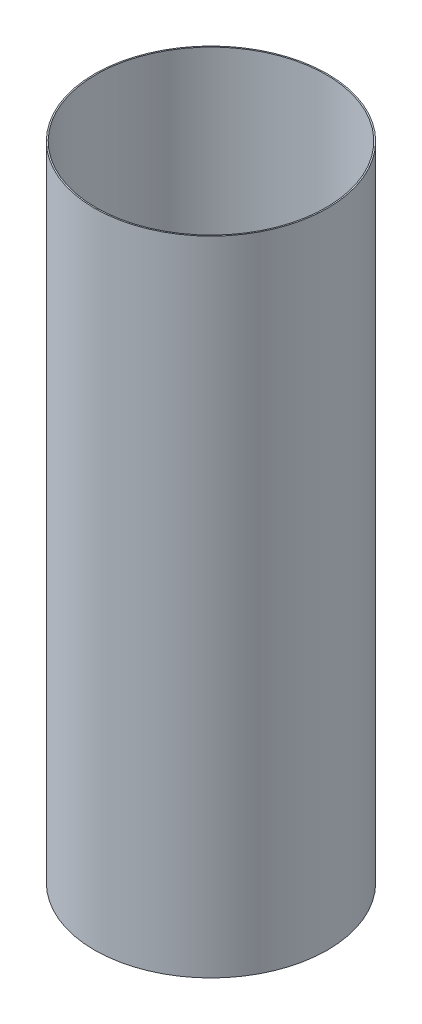
from build123d import *

# Parameters (mm, degrees)
SKETCH1_R           = 73.66
SKETCH1_R_2         = 72.8472
BOSS_EXTRUDE1_DEPTH = 406.4


with BuildPart() as part:
    # Sketch1 → Boss-Extrude1 (new body)
    with BuildSketch(Plane(origin=(0, 0, 0), x_dir=(1, 0, 0), z_dir=(0, 1, 0))):
        with Locations(Location((0, 0, 0), (0, 0, 270))):
            Circle(SKETCH1_R)
        with Locations(Location((0, 0, 0), (0, 0, 270))):
            Circle(SKETCH1_R_2, mode=Mode.SUBTRACT)
    extrude(amount=BOSS_EXTRUDE1_DEPTH)


solid = part.part
